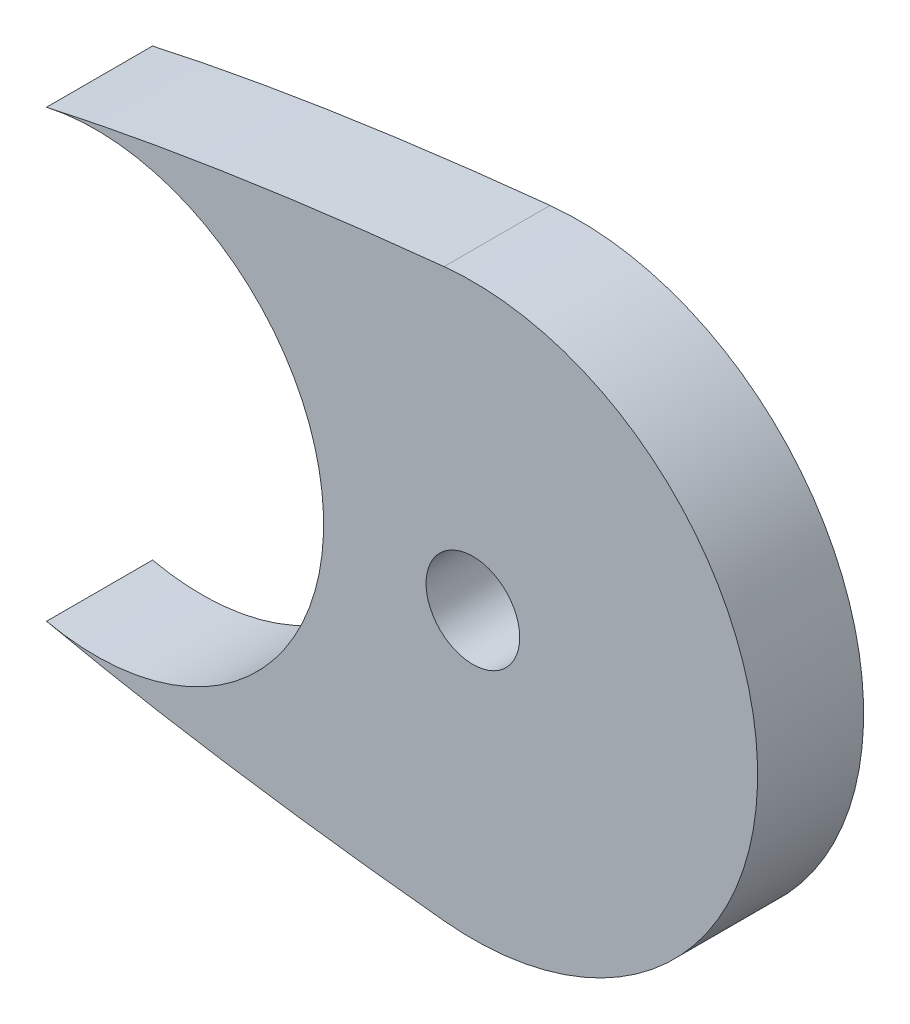
from build123d import *

# Parameters (mm, degrees)
SKETCH2_R           = 2.65
BOSS_EXTRUDE2_DEPTH = 6


with BuildPart() as part:
    # Sketch2 → Boss-Extrude2 (new body)
    with BuildSketch(Plane.XY):
        with BuildLine():
            add(Edge.make_bspline(
                [(45, 16.035396523), (44.644632939, 15.999223801), (41.619048326, 15.685620583), (36.155474951, 15.030554758), (29.005619164, 13.923317691), (24.539912926, 13.049943774), (22.5, 12.599580353)],
                knots=[0.418410632, 0.418410632, 0.418410632, 0.418410632, 0.420162443, 0.433328265, 0.445393603, 0.455638041, 0.455638041, 0.455638041, 0.455638041], degree=3))
            ThreePointArc((22.5, 12.599580353), (38.184673742, 0), (22.5, -12.599580353))
            add(Edge.make_bspline(
                [(22.5, -12.599580353), (24.539912926, -13.049943774), (29.005619164, -13.923317691), (36.155474951, -15.030554758), (41.619048326, -15.685620583), (44.644632939, -15.999223801), (45, -16.035396523)],
                knots=[0.544361959, 0.544361959, 0.544361959, 0.544361959, 0.554606397, 0.566671735, 0.579837557, 0.581589368, 0.581589368, 0.581589368, 0.581589368], degree=3))
            ThreePointArc((45, -16.035396523), (62.750493933, 0), (45, 16.035396523))
        make_face()
        with Locations((46.632238895, 0)):
            Circle(SKETCH2_R, mode=Mode.SUBTRACT)
    extrude(amount=BOSS_EXTRUDE2_DEPTH)


solid = part.part
